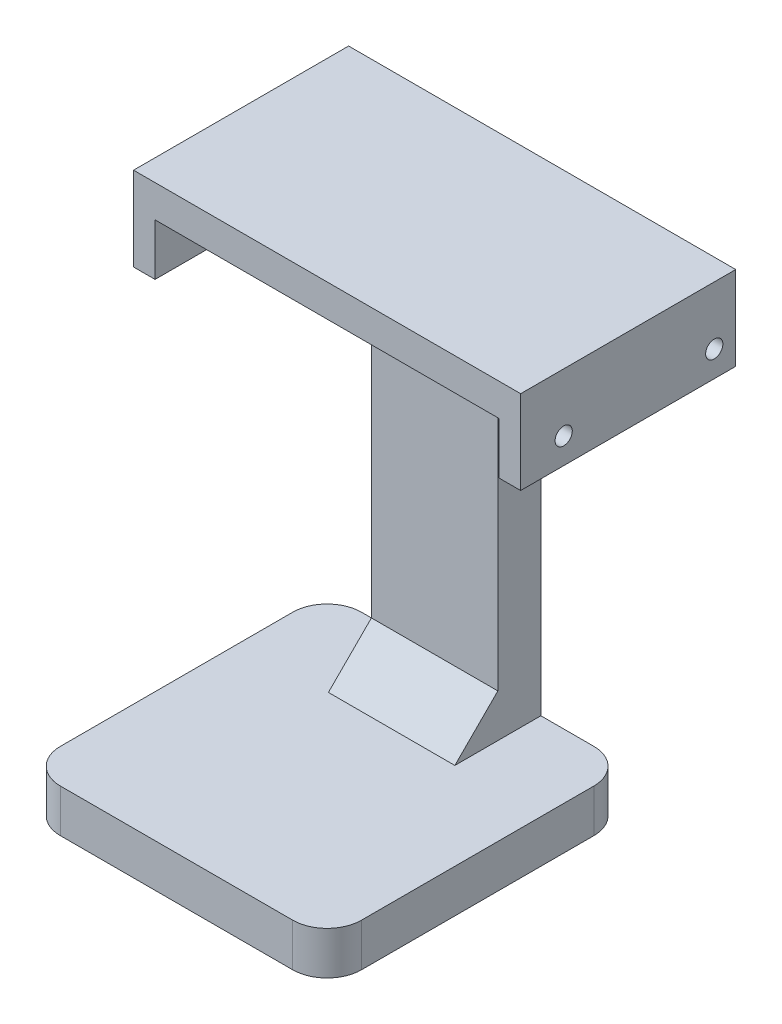
from build123d import *

# Parameters (mm, degrees)
EXTRUDE_2_DEPTH          = 35
EXTRUDE_START            = -100
SKETCH_3_W               = 70
SKETCH_3_H               = 70
EXTRUDE_3_DEPTH          = 10
CUT_EXTRUDE_START        = 35
SKETCH_4_W               = 29.4
SKETCH_4_H               = 90
CUT_EXTRUDE_1_DEPTH      = 25
CHAMFER_1_SIZE           = 10
EXTRUDE_4_DEPTH          = 15
CHAMFER_2_SIZE           = 5
CUT_EXTRUDE_2_DEPTH      = 131.096118313
CUT_EXTRUDE_2_DEPTH_BACK = 131.096118313
SKETCH_6_R               = 2
FILLET_2_R               = 8


with BuildPart() as part:
    # 草图2 → 凸台-拉伸2 (new body)
    with BuildSketch(Plane.XY):
        Polygon((-45, 7.5), (45, 7.5), (45, -12), (40, -12), (40, 0), (14.7, 0), (14.7, -100), (-14.7, -100), (-14.7, 0), (-40, 0), (-40, -12), (-45, -12), align=None)
    extrude(amount=EXTRUDE_2_DEPTH)

    # 草图3 → 凸台-拉伸3 (add)
    with BuildSketch(Plane(origin=(0, 0, 0), x_dir=(1, 0, 0), z_dir=(0, 1, 0)).offset(EXTRUDE_START)):
        with Locations((0, -35)):
            Rectangle(SKETCH_3_W, SKETCH_3_H)
    extrude(amount=EXTRUDE_3_DEPTH)

    # 草图4 → 切除-拉伸1 (cut)
    with BuildSketch(Plane.XY.offset(CUT_EXTRUDE_START)):
        with Locations((0, -45)):
            Rectangle(SKETCH_4_W, SKETCH_4_H)
    extrude(amount=-CUT_EXTRUDE_1_DEPTH, mode=Mode.SUBTRACT)

    # 倒角1
    chamfer_1_edges = [part.edges().sort_by_distance(p)[0] for p in [
        (0, 0, 10),
        (0, -90, 10),
    ]]
    chamfer(chamfer_1_edges, length=CHAMFER_1_SIZE)

    # 草图5 → 凸台-拉伸4 (add)
    with BuildSketch(Plane.XY):
        Polygon((40, -12), (45, -12), (45, 7.5), (-45, 7.5), (-45, -12), (-40, -12), (-40, 0), (40, 0), align=None)
    extrude(amount=-EXTRUDE_4_DEPTH)

    # 倒角2
    chamfer_2_edges = [part.edges().sort_by_distance(p)[0] for p in [
        (0, 0, 0),
    ]]
    chamfer(chamfer_2_edges, length=CHAMFER_2_SIZE)

    # 草图6 → 切除-拉伸2 (cut, two sides: drawn at the far end of the back side and taken through both)
    with BuildSketch(Plane(origin=(0, 0, 0), x_dir=(0, 0, -1), z_dir=(1, 0, 0)).offset(-CUT_EXTRUDE_2_DEPTH_BACK)):
        with Locations((10, -6)):
            Circle(SKETCH_6_R)
        with Locations((-25, -6)):
            Circle(SKETCH_6_R)
    extrude(amount=CUT_EXTRUDE_2_DEPTH + CUT_EXTRUDE_2_DEPTH_BACK, mode=Mode.SUBTRACT)

    # 圆角2
    fillet_2_edges = [part.edges().sort_by_distance(p)[0] for p in [
        (35, -95, 0),
        (-35, -95, 0),
        (-35, -95, 70),
        (35, -95, 70),
    ]]
    fillet(fillet_2_edges, radius=FILLET_2_R)


solid = part.part
